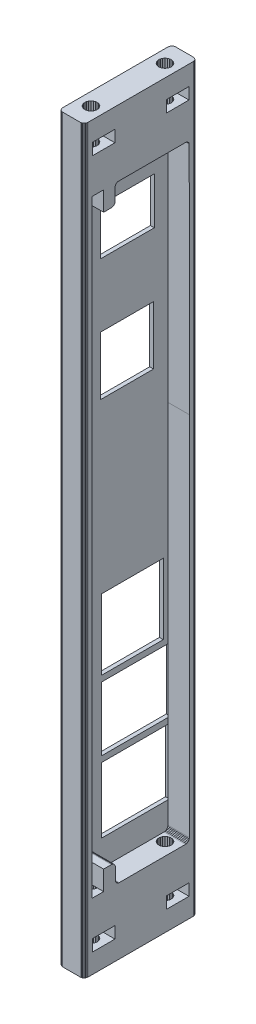
from build123d import *

# Parameters (mm, degrees)
BOSS_EXTRUDE1_DEPTH = 189.99999523
SKETCH2_W           = 5.800001324
SKETCH2_H           = 3.000000491
CUT_EXTRUDE1_DEPTH  = 146.045679533
CUT_EXTRUDE2_REACH  = 202.516
SKETCH4_W           = 5.800001324
SKETCH4_H           = 2.999998629
CUT_EXTRUDE3_DEPTH  = 146.045679533
SKETCH5_W           = 5.800001323
SKETCH5_H           = 2.999998629
CUT_EXTRUDE4_DEPTH  = 146.045679533
CUT_EXTRUDE5_REACH  = 202.516
CUT_EXTRUDE6_REACH  = 202.516
SKETCH8_W           = 5.800001323
SKETCH8_H           = 3.000000491
CUT_EXTRUDE7_DEPTH  = 146.045679533
CUT_EXTRUDE8_REACH  = 202.516
CUT_EXTRUDE9_DEPTH  = 5.49999997
CUT_EXTRUDE10_DEPTH = 9.000003338
CUT_EXTRUDE11_DEPTH = 9.000003338
CUT_EXTRUDE12_DEPTH = 8.99999754
CUT_EXTRUDE13_DEPTH = 8.99999754
CUT_EXTRUDE14_REACH = 147.004
SKETCH15_W          = 13.6
SKETCH15_H          = 15
SKETCH15_W_2        = 13.8
SKETCH15_H_2        = 12
SKETCH15_W_3        = 15.8
SKETCH15_H_3        = 18.1
SKETCH15_W_4        = 17.6
SKETCH15_H_4        = 16.4
SKETCH15_W_5        = 17.4
SKETCH15_H_5        = 16.8


with BuildPart() as part:
    # Sketch1 → Boss-Extrude1 (new body)
    with BuildSketch(Plane(origin=(0, 129.999995232, 0), x_dir=(1, 0, 0), z_dir=(0, 1, 0))):
        Polygon((-2.749999985, 35.133976489), (-2.508819103, 35.034071654), (-2.249999903, 35.000000149), (2.249999903, 35.000000149), (2.508819103, 35.034071654), (2.749999985, 35.133976489), (2.957106801, 35.292893648), (3.116025357, 35.500001162), (3.215926001, 35.741180182), (3.250000067, 35.99999845), (3.250000067, 63.000001013), (3.215926001, 63.258819282), (3.116025357, 63.500002027), (2.957106801, 63.707105815), (2.749999985, 63.8660267), (2.508819103, 63.965924084), (2.249999903, 64.00000304), (-2.249999903, 64.00000304), (-2.508819103, 63.965924084), (-2.749999985, 63.8660267), (-2.957106801, 63.707105815), (-3.116025357, 63.500002027), (-3.215926001, 63.258819282), (-3.250000067, 63.000001013), (-3.250000067, 35.99999845), (-3.215926001, 35.741180182), (-3.116025357, 35.500001162), (-2.957106801, 35.292893648), align=None)
    extrude(amount=-BOSS_EXTRUDE1_DEPTH)

    # Sketch2 → Cut-Extrude1 (cut, through all)
    with BuildSketch(Plane(origin=(3.250000067, 0, 0), x_dir=(0, 0, -1), z_dir=(1, 0, 0))):
        with Locations((39.999999106, -53.499999753)):
            Rectangle(SKETCH2_W, SKETCH2_H)
    extrude(amount=-CUT_EXTRUDE1_DEPTH, mode=Mode.SUBTRACT)

    # Sketch3 → Cut-Extrude2 (cut, up to next)
    with BuildSketch(Plane.XZ.offset(59.999999998), mode=Mode.PRIVATE) as cut_extrude2_sk1:
        Polygon((-1.545481267, -40.414113551), (-1.385640586, -40.799997747), (-1.131370896, -41.13136977), (-0.800000038, -41.385639459), (-0.414110487, -41.545484215), (0, -41.600000113), (0.414110487, -41.545484215), (0.800000038, -41.385639459), (1.131370896, -41.13136977), (1.385640586, -40.799997747), (1.545481267, -40.414113551), (1.600000076, -39.999999106), (1.545481267, -39.585888386), (1.385640586, -39.200000465), (1.131370896, -38.868628442), (0.800000038, -38.614362478), (0.414110487, -38.454517722), (0, -38.400001824), (-0.414110487, -38.454517722), (-0.800000038, -38.614362478), (-1.131370896, -38.868628442), (-1.385640586, -39.200000465), (-1.545481267, -39.585888386), (-1.600000076, -39.999999106), align=None)
    cut_extrude2_tool1 = extrude(cut_extrude2_sk1.sketch, amount=-CUT_EXTRUDE2_REACH, mode=Mode.PRIVATE) & part.part
    add(cut_extrude2_tool1.solids().sort_by_distance((0, -60, -40))[0], mode=Mode.SUBTRACT)

    # Sketch4 → Cut-Extrude3 (cut, through all)
    with BuildSketch(Plane(origin=(3.250000067, 0, 0), x_dir=(0, 0, -1), z_dir=(1, 0, 0))):
        with Locations((39.999999106, 123.500000686)):
            Rectangle(SKETCH4_W, SKETCH4_H)
    extrude(amount=-CUT_EXTRUDE3_DEPTH, mode=Mode.SUBTRACT)

    # Sketch5 → Cut-Extrude4 (cut, through all)
    with BuildSketch(Plane(origin=(3.250000067, 0, 0), x_dir=(0, 0, -1), z_dir=(1, 0, 0))):
        with Locations((59.000000357, 123.500000686)):
            Rectangle(SKETCH5_W, SKETCH5_H)
    extrude(amount=-CUT_EXTRUDE4_DEPTH, mode=Mode.SUBTRACT)

    # Sketch6 → Cut-Extrude5 (cut, up to next)
    with BuildSketch(Plane(origin=(0, 129.999995232, 0), x_dir=(-1, 0, 0), z_dir=(0, 1, 0)), mode=Mode.PRIVATE) as cut_extrude5_sk1:
        Polygon((1.545481267, -39.585888386), (1.385640586, -39.200000465), (1.131370896, -38.868628442), (0.800000038, -38.614362478), (0.414110487, -38.454517722), (0, -38.400001824), (-0.414110487, -38.454517722), (-0.800000038, -38.614362478), (-1.131370896, -38.868628442), (-1.385640586, -39.200000465), (-1.545481267, -39.585888386), (-1.600000076, -39.999999106), (-1.545481267, -40.414113551), (-1.385640586, -40.799997747), (-1.131370896, -41.13136977), (-0.800000038, -41.385639459), (-0.414110487, -41.545484215), (0, -41.600000113), (0.414110487, -41.545484215), (0.800000038, -41.385639459), (1.131370896, -41.13136977), (1.385640586, -40.799997747), (1.545481267, -40.414113551), (1.600000076, -39.999999106), align=None)
    cut_extrude5_tool1 = extrude(cut_extrude5_sk1.sketch, amount=-CUT_EXTRUDE5_REACH, mode=Mode.PRIVATE) & part.part
    add(cut_extrude5_tool1.solids().sort_by_distance((0, 129.999995, -40))[0], mode=Mode.SUBTRACT)

    # Sketch7 → Cut-Extrude6 (cut, up to next)
    with BuildSketch(Plane(origin=(0, 129.999995232, 0), x_dir=(-1, 0, 0), z_dir=(0, 1, 0)), mode=Mode.PRIVATE) as cut_extrude6_sk1:
        Polygon((-1.600000076, -59.000000358), (-1.545481267, -59.414111078), (-1.385640586, -59.799998999), (-1.131370896, -60.131371021), (-0.800000038, -60.385640711), (-0.414110487, -60.545481741), (0, -60.59999764), (0.414110487, -60.545481741), (0.800000038, -60.385640711), (1.131370896, -60.131371021), (1.385640586, -59.799998999), (1.545481267, -59.414111078), (1.600000076, -59.000000358), (1.545481267, -58.585889637), (1.385640586, -58.200001717), (1.131370896, -57.868629694), (0.800000038, -57.614360005), (0.414110487, -57.454518974), (0, -57.400003076), (-0.414110487, -57.454518974), (-0.800000038, -57.614360005), (-1.131370896, -57.868629694), (-1.385640586, -58.200001717), (-1.545481267, -58.585889637), align=None)
    cut_extrude6_tool1 = extrude(cut_extrude6_sk1.sketch, amount=-CUT_EXTRUDE6_REACH, mode=Mode.PRIVATE) & part.part
    add(cut_extrude6_tool1.solids().sort_by_distance((0, 129.999995, -59))[0], mode=Mode.SUBTRACT)

    # Sketch8 → Cut-Extrude7 (cut, through all)
    with BuildSketch(Plane(origin=(3.250000067, 0, 0), x_dir=(0, 0, -1), z_dir=(1, 0, 0))):
        with Locations((59.000000357, -53.499999753)):
            Rectangle(SKETCH8_W, SKETCH8_H)
    extrude(amount=-CUT_EXTRUDE7_DEPTH, mode=Mode.SUBTRACT)

    # Sketch9 → Cut-Extrude8 (cut, up to next)
    with BuildSketch(Plane.XZ.offset(59.999999998), mode=Mode.PRIVATE) as cut_extrude8_sk1:
        Polygon((-0.800000038, -57.614360005), (-1.131370896, -57.868629694), (-1.385640586, -58.200001717), (-1.545481267, -58.585889637), (-1.600000076, -59.000000358), (-1.545481267, -59.414111078), (-1.385640586, -59.799998999), (-1.131370896, -60.131371021), (-0.800000038, -60.385640711), (-0.414110487, -60.545481741), (0, -60.59999764), (0.414110487, -60.545481741), (0.800000038, -60.385640711), (1.131370896, -60.131371021), (1.385640586, -59.799998999), (1.545481267, -59.414111078), (1.600000076, -59.000000358), (1.545481267, -58.585889637), (1.385640586, -58.200001717), (1.131370896, -57.868629694), (0.800000038, -57.614360005), (0.414110487, -57.454518974), (0, -57.400003076), (-0.414110487, -57.454518974), align=None)
    cut_extrude8_tool1 = extrude(cut_extrude8_sk1.sketch, amount=-CUT_EXTRUDE8_REACH, mode=Mode.PRIVATE) & part.part
    add(cut_extrude8_tool1.solids().sort_by_distance((0, -60, -59))[0], mode=Mode.SUBTRACT)

    # Sketch10 → Cut-Extrude9 (cut)
    with BuildSketch(Plane(origin=(3.250000067, 0, 0), x_dir=(0, 0, -1), z_dir=(1, 0, 0))):
        with BuildLine():
            Line((61.999998987, -42.000003666), (61.999998987, 52.000000566))
            Line((61.999998987, 52.000000566), (61.965927482, 112.258821726))
            Line((61.965927482, 112.258821726), (61.866022646, 112.49999702))
            Line((61.866022646, 112.49999702), (61.707109213, 112.707108259))
            Line((61.707109213, 112.707108259), (61.500001699, 112.866029143))
            Line((61.500001699, 112.866029143), (61.258818954, 112.965926528))
            Line((61.258818954, 112.965926528), (61.000000685, 112.999998033))
            Line((61.000000685, 112.999998033), (43.999999762, 112.999998033))
            ThreePointArc((43.999999762, 112.999998033), (43.329460356, 112.84357352), (42.96592623, 112.258821726))
            Line((42.96592623, 112.258821726), (42.96592623, 108.74117434))
            Line((42.96592623, 108.74117434), (42.86602512, 108.499991596))
            Line((42.86602512, 108.499991596), (42.707107961, 108.292887807))
            Line((42.707107961, 108.292887807), (42.500000447, 108.133966923))
            Line((42.500000447, 108.133966923), (42.258821428, 108.034069538))
            Line((42.258821428, 108.034069538), (41.999999434, 107.999998033))
            Line((41.999999434, 107.999998033), (39.999999106, 107.999998033))
            Line((39.999999106, 107.999998033), (39.999999106, 112.999998033))
            Line((39.999999106, 112.999998033), (37.000000477, 112.999998033))
            Line((37.000000477, 112.999998033), (37.000000477, -43.000001967))
            Line((37.000000477, -43.000001967), (39.999999106, -43.000001967))
            Line((39.999999106, -43.000001967), (39.999999106, -38.00000301))
            Line((39.999999106, -38.00000301), (41.999999434, -38.00000301))
            Line((41.999999434, -38.00000301), (42.258821428, -38.03407824))
            Line((42.258821428, -38.03407824), (42.500000447, -38.133977488))
            Line((42.500000447, -38.133977488), (42.707107961, -38.292894647))
            Line((42.707107961, -38.292894647), (42.86602512, -38.500002161))
            Line((42.86602512, -38.500002161), (42.96592623, -38.741183043))
            Line((42.96592623, -38.741183043), (43.00000146, -39.000003174))
            Line((43.00000146, -39.000003174), (43.00000146, -42.000003666))
            Line((43.00000146, -42.000003666), (43.034072965, -42.258821934))
            Line((43.034072965, -42.258821934), (43.133977801, -42.500002816))
            Line((43.133977801, -42.500002816), (43.292891234, -42.70711033))
            Line((43.292891234, -42.70711033), (43.499998748, -42.866029352))
            Line((43.499998748, -42.866029352), (43.741181493, -42.965928599))
            Line((43.741181493, -42.965928599), (43.999999762, -43.000001967))
            Line((43.999999762, -43.000001967), (61.000000685, -43.000001967))
            Line((61.000000685, -43.000001967), (61.258818954, -42.965928599))
            Line((61.258818954, -42.965928599), (61.500001699, -42.866029352))
            Line((61.500001699, -42.866029352), (61.707109213, -42.70711033))
            Line((61.707109213, -42.70711033), (61.866022646, -42.500002816))
            Line((61.866022646, -42.500002816), (61.965927482, -42.258821934))
            Line((61.965927482, -42.258821934), (61.999998987, -42.000003666))
        make_face()
    extrude(amount=-CUT_EXTRUDE9_DEPTH, mode=Mode.SUBTRACT)

    # Sketch11 → Cut-Extrude10 (cut)
    with BuildSketch(Plane(origin=(0, 122.000001371, 0), x_dir=(-1, 0, 0), z_dir=(0, 1, 0))):
        Polygon((1.545481267, -40.414113551), (1.600000076, -39.999999106), (1.545481267, -39.585888386), (1.385640586, -39.200000465), (1.131370896, -38.868628442), (0.800000038, -38.614362478), (0.414110487, -38.454517722), (0, -38.400001824), (-0.414110487, -38.454517722), (-0.800000038, -38.614362478), (-1.131370896, -38.868628442), (-1.385640586, -39.200000465), (-1.545481267, -39.585888386), (-1.600000076, -39.999999106), (-1.545481267, -40.414113551), (-1.385640586, -40.799997747), (-1.131370896, -41.13136977), (-0.800000038, -41.385639459), (-0.414110487, -41.545484215), (0, -41.600000113), (0.414110487, -41.545484215), (0.800000038, -41.385639459), (1.131370896, -41.13136977), (1.385640586, -40.799997747), align=None)
    extrude(amount=-CUT_EXTRUDE10_DEPTH, mode=Mode.SUBTRACT)

    # Sketch12 → Cut-Extrude11 (cut)
    with BuildSketch(Plane(origin=(0, 122.000001371, 0), x_dir=(-1, 0, 0), z_dir=(0, 1, 0))):
        Polygon((1.545481267, -59.414111078), (1.600000076, -59.000000358), (1.545481267, -58.585889637), (1.385640586, -58.200001717), (1.131370896, -57.868629694), (0.800000038, -57.614360005), (0.414110487, -57.454518974), (0, -57.400003076), (-0.414110487, -57.454518974), (-0.800000038, -57.614360005), (-1.131370896, -57.868629694), (-1.385640586, -58.200001717), (-1.545481267, -58.585889637), (-1.600000076, -59.000000358), (-1.545481267, -59.414111078), (-1.385640586, -59.799998999), (-1.131370896, -60.131371021), (-0.800000038, -60.385640711), (-0.414110487, -60.545481741), (0, -60.59999764), (0.414110487, -60.545481741), (0.800000038, -60.385640711), (1.131370896, -60.131371021), (1.385640586, -59.799998999), align=None)
    extrude(amount=-CUT_EXTRUDE11_DEPTH, mode=Mode.SUBTRACT)

    # Sketch13 → Cut-Extrude12 (cut)
    with BuildSketch(Plane.XZ.offset(51.999999507)):
        Polygon((-0.414110487, -41.545484215), (0, -41.600000113), (0.414110487, -41.545484215), (0.800000038, -41.385639459), (1.131370896, -41.13136977), (1.385640586, -40.799997747), (1.545481267, -40.414113551), (1.600000076, -39.999999106), (1.545481267, -39.585888386), (1.385640586, -39.200000465), (1.131370896, -38.868628442), (0.800000038, -38.614362478), (0.414110487, -38.454517722), (0, -38.400001824), (-0.414110487, -38.454517722), (-0.800000038, -38.614362478), (-1.131370896, -38.868628442), (-1.385640586, -39.200000465), (-1.545481267, -39.585888386), (-1.600000076, -39.999999106), (-1.545481267, -40.414113551), (-1.385640586, -40.799997747), (-1.131370896, -41.13136977), (-0.800000038, -41.385639459), align=None)
    extrude(amount=-CUT_EXTRUDE12_DEPTH, mode=Mode.SUBTRACT)

    # Sketch14 → Cut-Extrude13 (cut)
    with BuildSketch(Plane.XZ.offset(51.999999507)):
        Polygon((-0.414110487, -60.545481741), (0, -60.59999764), (0.414110487, -60.545481741), (0.800000038, -60.385640711), (1.131370896, -60.131371021), (1.385640586, -59.799998999), (1.545481267, -59.414111078), (1.600000076, -59.000000358), (1.545481267, -58.585889637), (1.385640586, -58.200001717), (1.131370896, -57.868629694), (0.800000038, -57.614360005), (0.414110487, -57.454518974), (0, -57.400003076), (-0.414110487, -57.454518974), (-0.800000038, -57.614360005), (-1.131370896, -57.868629694), (-1.385640586, -58.200001717), (-1.545481267, -58.585889637), (-1.600000076, -59.000000358), (-1.545481267, -59.414111078), (-1.385640586, -59.799998999), (-1.131370896, -60.131371021), (-0.800000038, -60.385640711), align=None)
    extrude(amount=-CUT_EXTRUDE13_DEPTH, mode=Mode.SUBTRACT)

    # Sketch15 → Cut-Extrude14 (cut, up to next)
    with BuildSketch(Plane(origin=(-2.249999903, 0, 0), x_dir=(0, 0, -1), z_dir=(1, 0, 0)), mode=Mode.PRIVATE) as cut_extrude14_sk1:
        with Locations((51.500000477, 68.749998033)):
            Rectangle(SKETCH15_W, SKETCH15_H)
    cut_extrude14_tool1 = extrude(cut_extrude14_sk1.sketch, amount=-CUT_EXTRUDE14_REACH, mode=Mode.PRIVATE) & part.part
    # Sketch15 → Cut-Extrude14 (cut, up to next)
    with BuildSketch(Plane(origin=(-2.249999903, 0, 0), x_dir=(0, 0, -1), z_dir=(1, 0, 0)), mode=Mode.PRIVATE) as cut_extrude14_sk2:
        with Locations((51.600000477, 98.549998033)):
            Rectangle(SKETCH15_W_2, SKETCH15_H_2)
    cut_extrude14_tool2 = extrude(cut_extrude14_sk2.sketch, amount=-CUT_EXTRUDE14_REACH, mode=Mode.PRIVATE) & part.part
    # Sketch15 → Cut-Extrude14 (cut, up to next)
    with BuildSketch(Plane(origin=(-2.249999903, 0, 0), x_dir=(0, 0, -1), z_dir=(1, 0, 0)), mode=Mode.PRIVATE) as cut_extrude14_sk3:
        with Locations((52.900000477, 8.899998033)):
            Rectangle(SKETCH15_W_3, SKETCH15_H_3)
    cut_extrude14_tool3 = extrude(cut_extrude14_sk3.sketch, amount=-CUT_EXTRUDE14_REACH, mode=Mode.PRIVATE) & part.part
    # Sketch15 → Cut-Extrude14 (cut, up to next)
    with BuildSketch(Plane(origin=(-2.249999903, 0, 0), x_dir=(0, 0, -1), z_dir=(1, 0, 0)), mode=Mode.PRIVATE) as cut_extrude14_sk4:
        with Locations((53.800000477, -9.850001967)):
            Rectangle(SKETCH15_W_4, SKETCH15_H_4)
    cut_extrude14_tool4 = extrude(cut_extrude14_sk4.sketch, amount=-CUT_EXTRUDE14_REACH, mode=Mode.PRIVATE) & part.part
    # Sketch15 → Cut-Extrude14 (cut, up to next)
    with BuildSketch(Plane(origin=(-2.249999903, 0, 0), x_dir=(0, 0, -1), z_dir=(1, 0, 0)), mode=Mode.PRIVATE) as cut_extrude14_sk5:
        with Locations((53.700000477, -27.950001967)):
            Rectangle(SKETCH15_W_5, SKETCH15_H_5)
    cut_extrude14_tool5 = extrude(cut_extrude14_sk5.sketch, amount=-CUT_EXTRUDE14_REACH, mode=Mode.PRIVATE) & part.part
    add(cut_extrude14_tool1.solids().sort_by_distance((-2.25, 68.749998, -51.5))[0], mode=Mode.SUBTRACT)
    add(cut_extrude14_tool2.solids().sort_by_distance((-2.25, 98.549998, -51.6))[0], mode=Mode.SUBTRACT)
    add(cut_extrude14_tool3.solids().sort_by_distance((-2.25, 8.899998, -52.9))[0], mode=Mode.SUBTRACT)
    add(cut_extrude14_tool4.solids().sort_by_distance((-2.25, -9.850002, -53.8))[0], mode=Mode.SUBTRACT)
    add(cut_extrude14_tool5.solids().sort_by_distance((-2.25, -27.950002, -53.7))[0], mode=Mode.SUBTRACT)


solid = part.part
